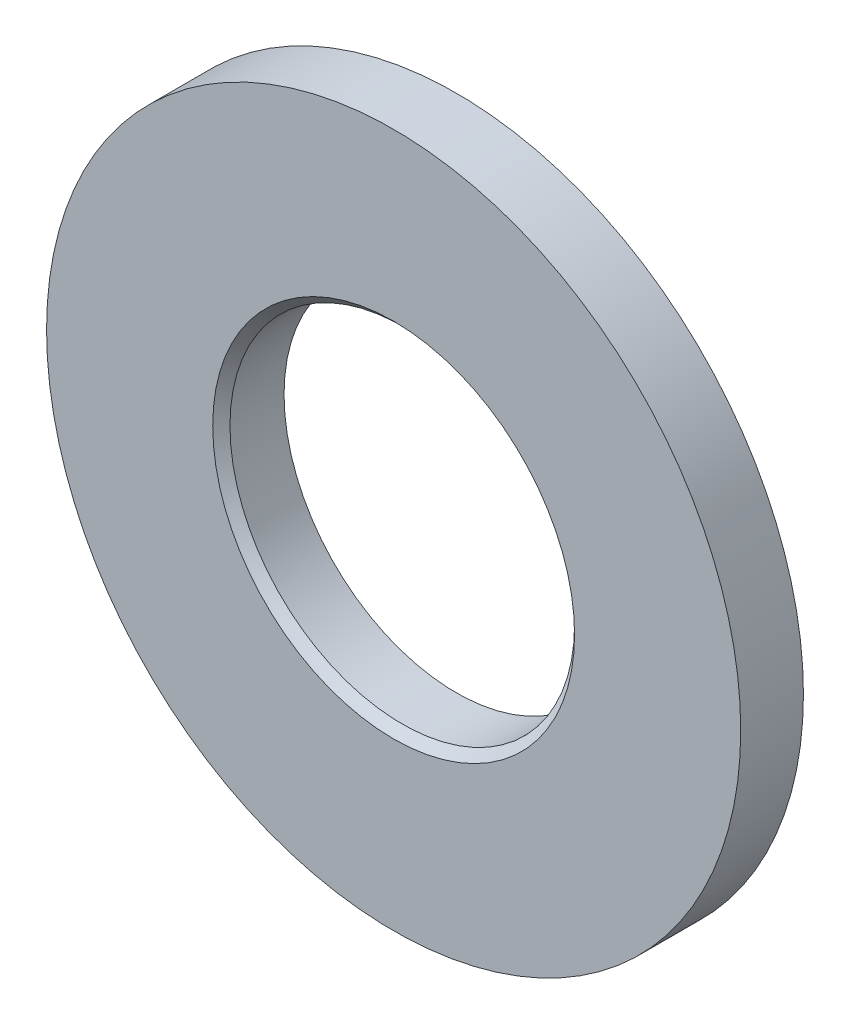
from build123d import *

# Parameters (mm, degrees)
SKETCH3_R           = 8.9281
SKETCH3_R_2         = 4.4323
BOSS_EXTRUDE1_DEPTH = 0.80645
CHAMFER1_SIZE       = 0.221615


with BuildPart() as part:
    # Sketch3 → Boss-Extrude1 (new, symmetric)
    with BuildSketch(Plane.XY):
        Circle(SKETCH3_R)
        Circle(SKETCH3_R_2, mode=Mode.SUBTRACT)
    extrude(amount=BOSS_EXTRUDE1_DEPTH, both=True)

    # Chamfer1
    chamfer1_edges = [part.edges().sort_by_distance(p)[0] for p in [
        (-4.4323, 0, 0.80645),
    ]]
    chamfer(chamfer1_edges, length=CHAMFER1_SIZE)


solid = part.part
